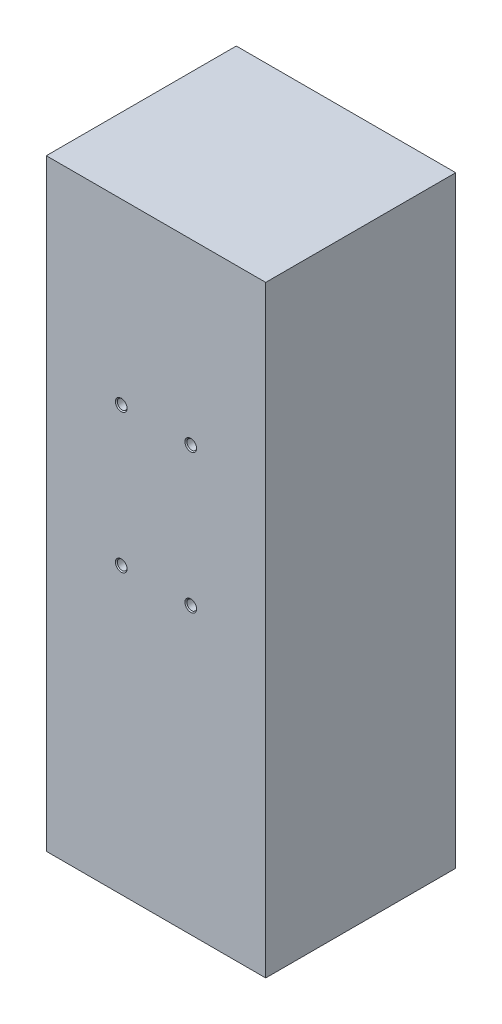
from build123d import *

# Parameters (mm, degrees)
SKETCH1_W                       = 94.7
SKETCH1_H                       = 82
BOSS_EXTRUDE1_DEPTH             = 130
M5X0_8_TAPPED_HOLE1_D           = 4.2
M5X0_8_TAPPED_HOLE1_DEPTH       = 12.4
M5X0_8_TAPPED_HOLE1_CSINK_D     = 5.05
M5X0_8_TAPPED_HOLE1_CSINK_ANGLE = 90
M5X0_8_TAPPED_HOLE1_TIP         = 1.2618073


with BuildPart() as part:
    # Sketch1 → Boss-Extrude1 (new, symmetric)
    with BuildSketch(Plane(origin=(0, 0, 0), x_dir=(1, 0, 0), z_dir=(0, 1, 0))):
        Rectangle(SKETCH1_W, SKETCH1_H)
    extrude(amount=BOSS_EXTRUDE1_DEPTH, both=True)

    # M5x0.8 Tapped Hole1
    with Locations(Plane.XY.offset(41)):
        with Locations((15, 53), (-15, 53), (-15, -7), (15, -7)):
            CounterSinkHole(M5X0_8_TAPPED_HOLE1_D / 2, M5X0_8_TAPPED_HOLE1_CSINK_D / 2, depth=M5X0_8_TAPPED_HOLE1_DEPTH, counter_sink_angle=M5X0_8_TAPPED_HOLE1_CSINK_ANGLE)
            with Locations((0, 0, -(M5X0_8_TAPPED_HOLE1_DEPTH + M5X0_8_TAPPED_HOLE1_TIP / 2))):  # 118° drill point
                Cone(0, M5X0_8_TAPPED_HOLE1_D / 2, M5X0_8_TAPPED_HOLE1_TIP, mode=Mode.SUBTRACT)


solid = part.part
